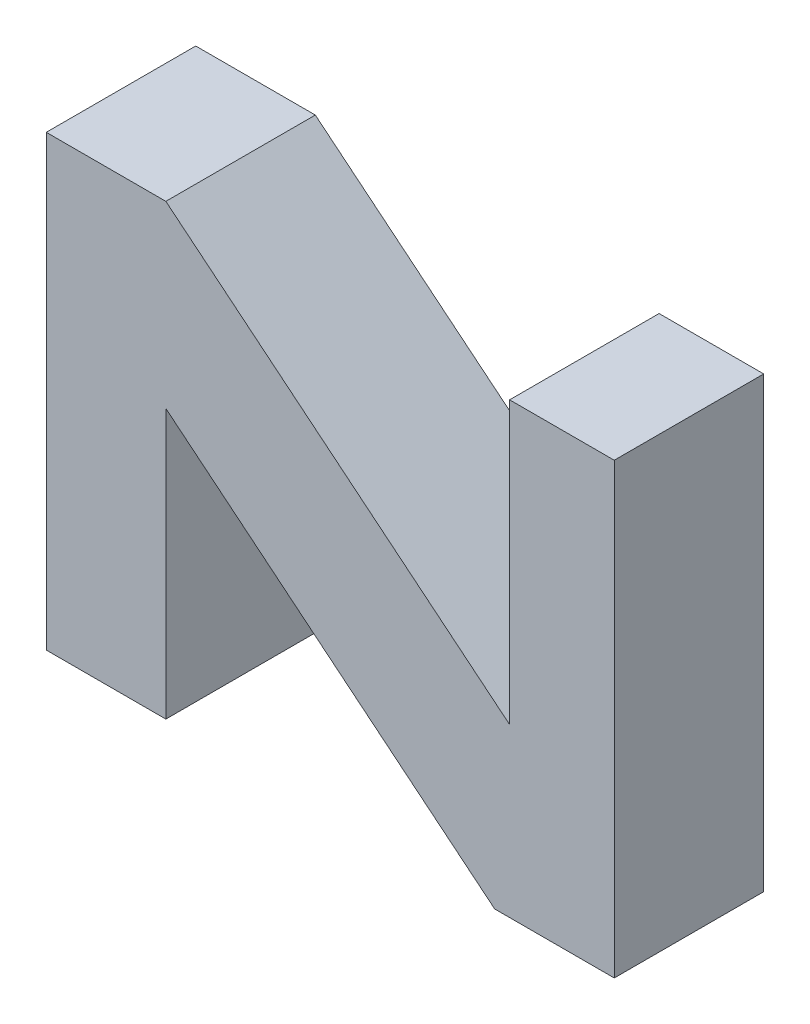
from build123d import *

# Parameters (mm, degrees)
BOSS_EXTRUDE1_DEPTH = 5


with BuildPart() as part:
    # Sketch1 → Boss-Extrude1 (new, symmetric)
    with BuildSketch(Plane.XY):
        Polygon((0, 0), (0, 30), (8, 30), (31, 11.181818182), (31, 30), (38, 30), (38, 0), (30, 0), (8, 18), (8, 0), align=None)
    extrude(amount=BOSS_EXTRUDE1_DEPTH, both=True)


solid = part.part
